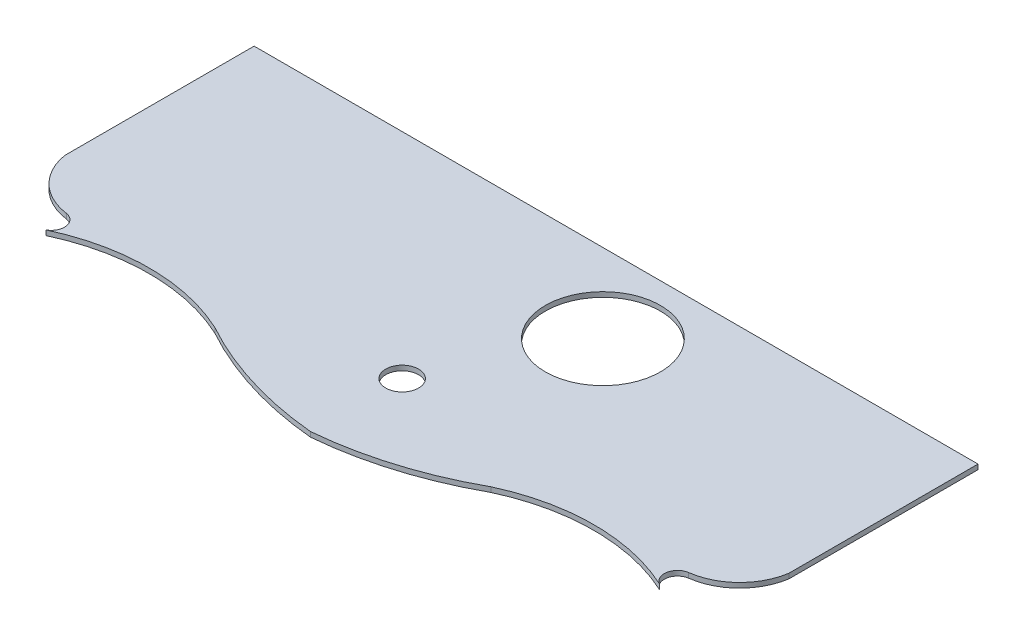
from build123d import *

# Parameters (mm, degrees)
SKETCH1_R           = 5
SKETCH1_R_2         = 17.5
BOSS_EXTRUDE1_DEPTH = 1.5


with BuildPart() as part:
    # Sketch1 → Boss-Extrude1 (new body)
    with BuildSketch(Plane(origin=(0, 3, 0), x_dir=(1, 0, 0), z_dir=(0, 1, 0))):
        with BuildLine():
            Line((-110, 50), (-110, -7.5))
            ThreePointArc((-110, -7.5), (-104.755451902, -17.601037804), (-94.5, -22.536820999))
            ThreePointArc((-94.5, -22.536820999), (-91.210601206, -25.822153148), (-93.25, -30))
            ThreePointArc((-93.25, -30), (-67.606257623, -24.318329423), (-41.962515246, -30))
            ThreePointArc((-41.962515246, -30), (-21.653208784, -38.627914511), (0, -42.876136156))
            ThreePointArc((0, -42.876136156), (21.653208784, -38.627914511), (41.962515246, -30))
            ThreePointArc((41.962515246, -30), (67.606257623, -24.318329423), (93.25, -30))
            ThreePointArc((93.25, -30), (91.210601206, -25.822153148), (94.5, -22.536820999))
            ThreePointArc((94.5, -22.536820999), (104.755451902, -17.601037804), (110, -7.5))
            Line((110, -7.5), (110, 50))
            Line((110, 50), (-110, 50))
        make_face()
        with Locations(Location((0, -15, 0), (0, 0, 270))):
            Circle(SKETCH1_R, mode=Mode.SUBTRACT)
        with Locations(Location((20, 26, 0), (0, 0, 270))):
            Circle(SKETCH1_R_2, mode=Mode.SUBTRACT)
    extrude(amount=BOSS_EXTRUDE1_DEPTH)


solid = part.part
